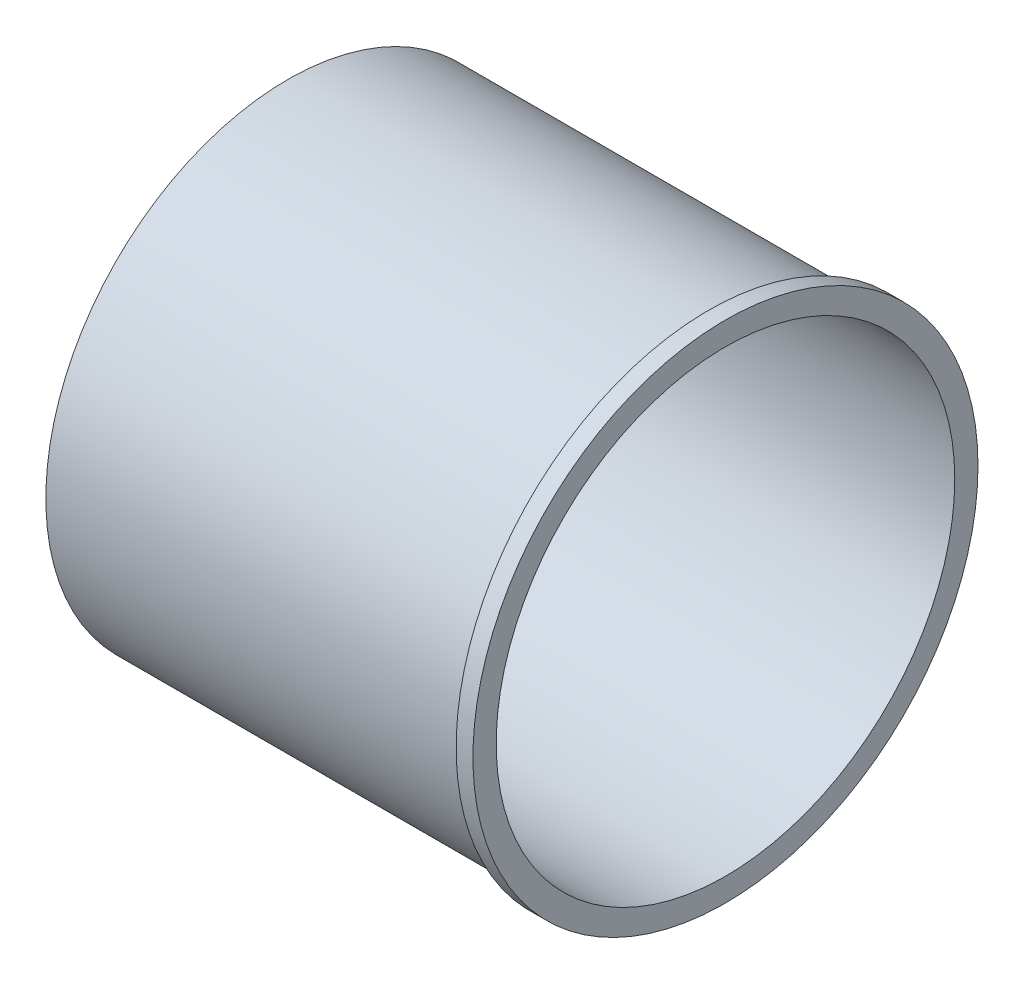
from build123d import *

# Parameters (mm, degrees)
SKETCH1_R           = 36.4998
SKETCH1_R_2         = 34.5948
BOSS_EXTRUDE1_DEPTH = 63.5
SKETCH2_R           = 38.1
SKETCH2_R_2         = 34.5948
BOSS_EXTRUDE2_DEPTH = 2.54


with BuildPart() as part:
    # Sketch1 → Boss-Extrude1 (new body)
    with BuildSketch(Plane.YZ):
        with Locations(Location((0, 0, 0), (0, 0, 270))):
            Circle(SKETCH1_R)
        with Locations(Location((0, 0, 0), (0, 0, 270))):
            Circle(SKETCH1_R_2, mode=Mode.SUBTRACT)
    extrude(amount=BOSS_EXTRUDE1_DEPTH)

    # Sketch2 → Boss-Extrude2 (add)
    with BuildSketch(Plane.YZ.offset(63.5)):
        with Locations(Location((0, 0, 0), (0, 0, 270))):
            Circle(SKETCH2_R)
        with Locations(Location((0, 0, 0), (0, 0, 270))):
            Circle(SKETCH2_R_2, mode=Mode.SUBTRACT)
    extrude(amount=BOSS_EXTRUDE2_DEPTH)


solid = part.part
